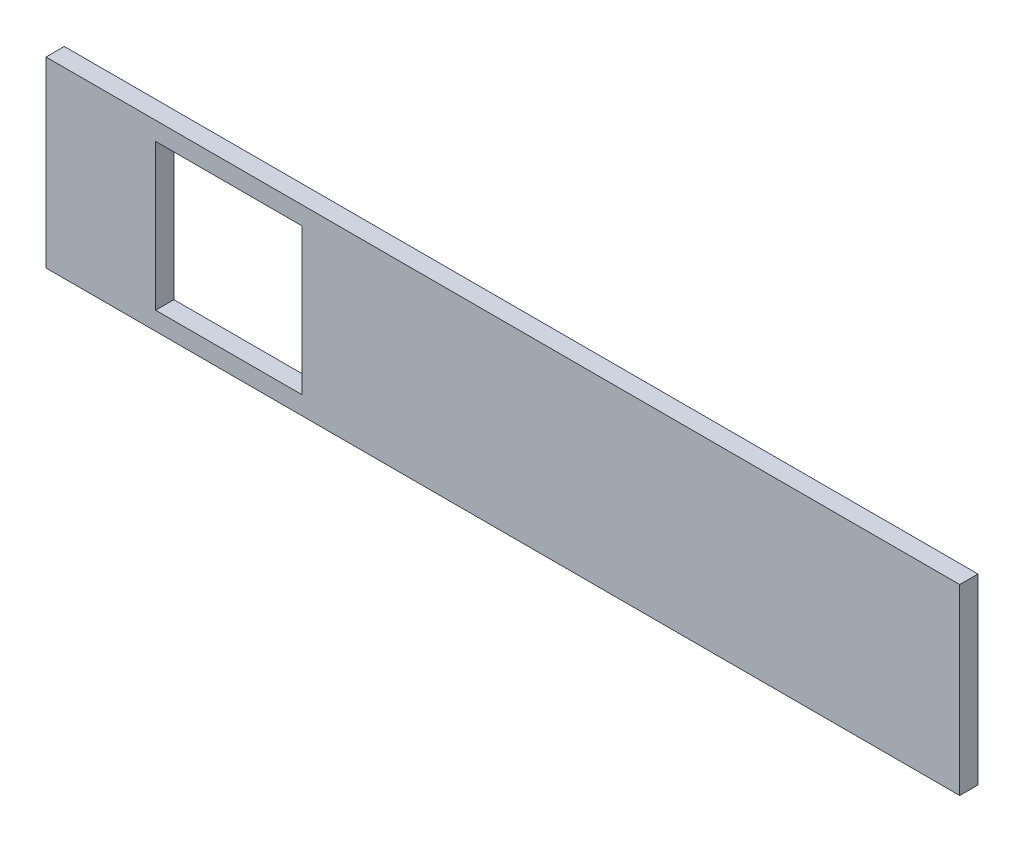
from build123d import *

# Parameters (mm, degrees)
ESQUISSE1_W        = 500
ESQUISSE1_H        = 100
ESQUISSE1_W_2      = 80
ESQUISSE1_H_2      = 80
BOSS_EXTRU_1_DEPTH = 10


with BuildPart() as part:
    # Esquisse1 → Boss.-Extru.1 (new body)
    with BuildSketch(Plane.XY):
        with Locations((-250, 50)):
            Rectangle(ESQUISSE1_W, ESQUISSE1_H)
        with Locations((-400, 50)):
            Rectangle(ESQUISSE1_W_2, ESQUISSE1_H_2, mode=Mode.SUBTRACT)
    extrude(amount=BOSS_EXTRU_1_DEPTH)


solid = part.part
